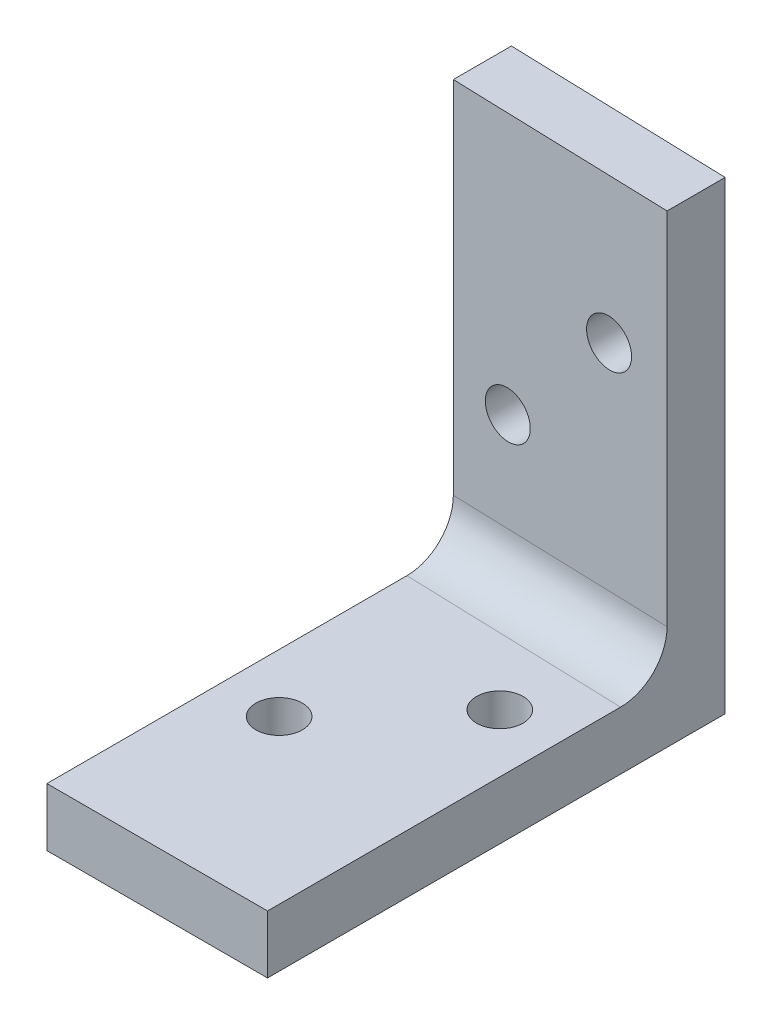
from build123d import *

# Parameters (mm, degrees)
SKETCH1_W           = 19
SKETCH1_H           = 40
BOSS_EXTRUDE1_DEPTH = 5
CUT_EXTRUDE1_DEPTH  = 23.699118926
BOSS_EXTRUDE2_DEPTH = 35
SKETCH4_R           = 2
CUT_EXTRUDE2_DEPTH  = 42.41557678
SKETCH5_R           = 2
CUT_EXTRUDE3_DEPTH  = 58.245495844
FILLET1_R           = 4


with BuildPart() as part:
    # Sketch1 → Boss-Extrude1 (new body)
    with BuildSketch(Plane(origin=(0, 0, 0), x_dir=(1, 0, 0), z_dir=(0, 1, 0))):
        Rectangle(SKETCH1_W, SKETCH1_H)
    extrude(amount=BOSS_EXTRUDE1_DEPTH)

    # Sketch2 → Cut-Extrude1 (cut, through all)
    with BuildSketch(Plane(origin=(0, 5, 0), x_dir=(1, 0, 0), z_dir=(0, 1, 0))):
        Polygon((-9.5, 20), (9.5, 19.402900945), (9.5, 20), align=None)
    extrude(amount=-CUT_EXTRUDE1_DEPTH, mode=Mode.SUBTRACT)

    # Sketch3 → Boss-Extrude2 (add)
    with BuildSketch(Plane(origin=(0, 5, 0), x_dir=(1, 0, 0), z_dir=(0, 1, 0))):
        Polygon((-9.5, 20), (9.5, 19.402900945), (9.5, 14.402900945), (-9.5, 15), align=None)
    extrude(amount=BOSS_EXTRUDE2_DEPTH)

    # Sketch4 → Cut-Extrude2 (cut, through all)
    with BuildSketch(Plane(origin=(0, 5, 0), x_dir=(1, 0, 0), z_dir=(0, 1, 0))):
        with Locations(Location((-4.5, -5, 0), (0, 0, 270))):
            Circle(SKETCH4_R)
        with Locations(Location((4.5, 5, 0), (0, 0, 270))):
            Circle(SKETCH4_R)
    extrude(amount=-CUT_EXTRUDE2_DEPTH, mode=Mode.SUBTRACT)

    # Sketch5 → Cut-Extrude3 (cut, through all)
    with BuildSketch(Plane(origin=(0.618532155, 0, -19.682012317), x_dir=(-0.9995065603657318, 0, -0.0314107590781213), z_dir=(0.0314107590781213, 0, -0.9995065603657318))):
        with Locations((-3.885852476, 27.5)):
            Circle(SKETCH5_R)
        with Locations((5.123527505, 17.5)):
            Circle(SKETCH5_R)
    extrude(amount=-CUT_EXTRUDE3_DEPTH, mode=Mode.SUBTRACT)

    # Fillet1
    fillet1_edges = [part.edges().sort_by_distance(p)[0] for p in [
        (0, 5, -14.701450473),
    ]]
    fillet(fillet1_edges, radius=FILLET1_R)


solid = part.part
